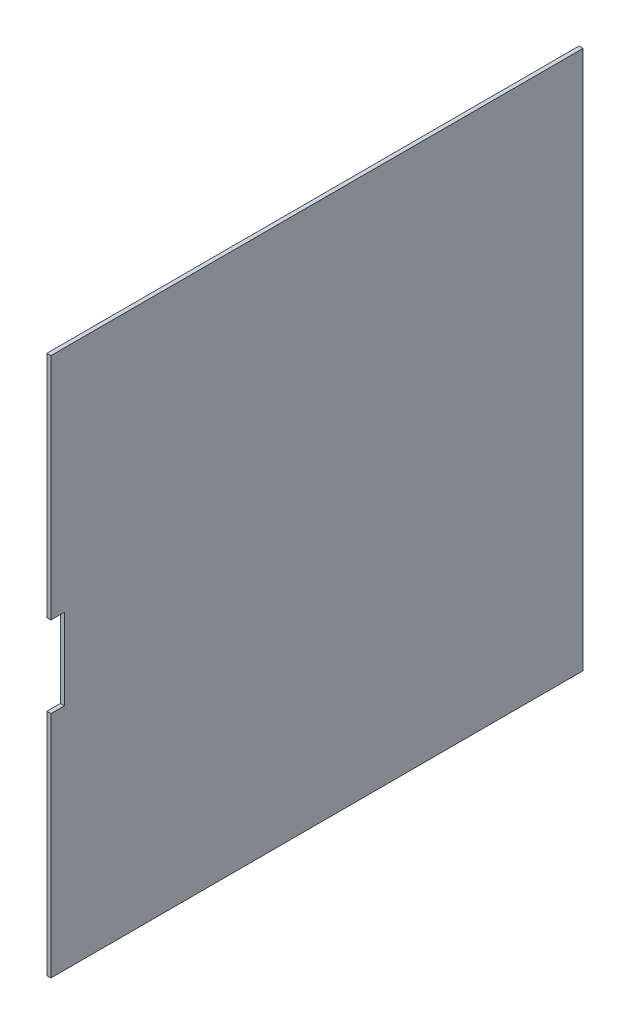
from build123d import *

# Parameters (mm, degrees)
SKETCH_1_W          = 394
SKETCH_1_H          = 399
EXTRUDE_1_DEPTH     = 3
SKETCH_2_W          = 10
SKETCH_2_H          = 60
CUT_EXTRUDE_1_DEPTH = 281.389461286


with BuildPart() as part:
    # 草圖1 → 填料-伸長1 (new body)
    with BuildSketch(Plane(origin=(0, 0, 0), x_dir=(0, 0, -1), z_dir=(1, 0, 0))):
        Rectangle(SKETCH_1_W, SKETCH_1_H)
    extrude(amount=EXTRUDE_1_DEPTH)

    # 草圖2 → 除料-伸長1 (cut, through all)
    with BuildSketch(Plane(origin=(3, 0, 0), x_dir=(0, 0, -1), z_dir=(1, 0, 0))):
        with Locations((-192, 0)):
            Rectangle(SKETCH_2_W, SKETCH_2_H)
    extrude(amount=-CUT_EXTRUDE_1_DEPTH, mode=Mode.SUBTRACT)


solid = part.part
